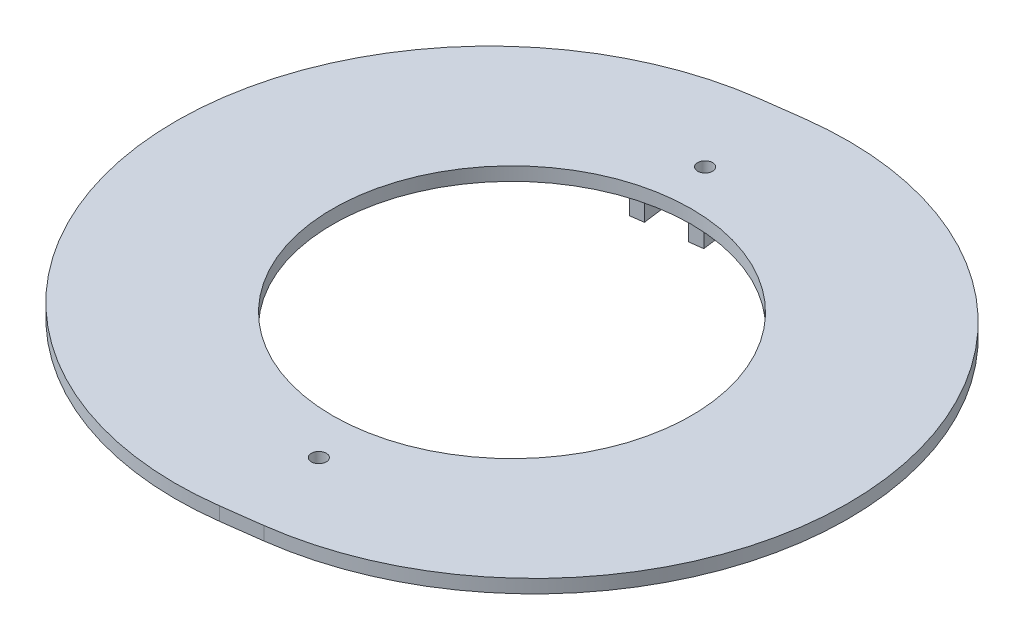
from build123d import *

# Parameters (mm, degrees)
SKETCH89_R          = 20
SKETCH89_R_2        = 0.836
BOSS_EXTRUDE1_DEPTH = 1.5
BOSS_EXTRUDE2_DEPTH = 2


with BuildPart() as part:
    # Sketch89 → Boss-Extrude1 (new body)
    with BuildSketch(Plane(origin=(0, 32.096297607, 0), x_dir=(1, 0, 0), z_dir=(0, 1, 0))):
        with BuildLine():
            Line((-6.77197393, 31.12758978), (-2.40961654, 31.701905026))
            ThreePointArc((-2.40961654, 31.701905026), (36.88994717, 1.546289176), (6.73433132, -37.753274534))
            Line((6.73433132, -37.753274534), (2.37197393, -38.32758978))
            ThreePointArc((2.37197393, -38.32758978), (-36.92758978, -8.17197393), (-6.77197393, 31.12758978))
        make_face()
        with Locations(Location((-0.018821305, -3.312842377, 0), (0, 0, 270))):
            Circle(SKETCH89_R, mode=Mode.SUBTRACT)
        with Locations(Location((3.247890703, -28.125983544, 0), (0, 0, 270))):
            Circle(SKETCH89_R_2, mode=Mode.SUBTRACT)
        with Locations(Location((-3.285533313, 21.500298789, 0), (0, 0, 270))):
            Circle(SKETCH89_R_2, mode=Mode.SUBTRACT)
    extrude(amount=BOSS_EXTRUDE1_DEPTH)

    # Sketch90 → Boss-Extrude2 (add)
    with BuildSketch(Plane.XZ.offset(-32.096297607)):
        Polygon((1.066712008, 28.413141166), (0.414081046, 23.45591686), (-1.073086246, 23.651706148), (-0.420455285, 28.608930455), align=None)
        Polygon((5.429069398, 27.838825921), (4.776438436, 22.881601614), (6.263605729, 22.685812325), (6.91623669, 27.643036632), align=None)
        Polygon((-0.451723656, -16.830232105), (-1.104354617, -21.787456412), (0.382812675, -21.9832457), (1.035443636, -17.026021394), align=None)
        Polygon((-5.466712008, -21.213141166), (-4.814081046, -16.25591686), (-6.301248339, -16.060127571), (-6.9538793, -21.017351878), align=None)
    extrude(amount=BOSS_EXTRUDE2_DEPTH)


solid = part.part
